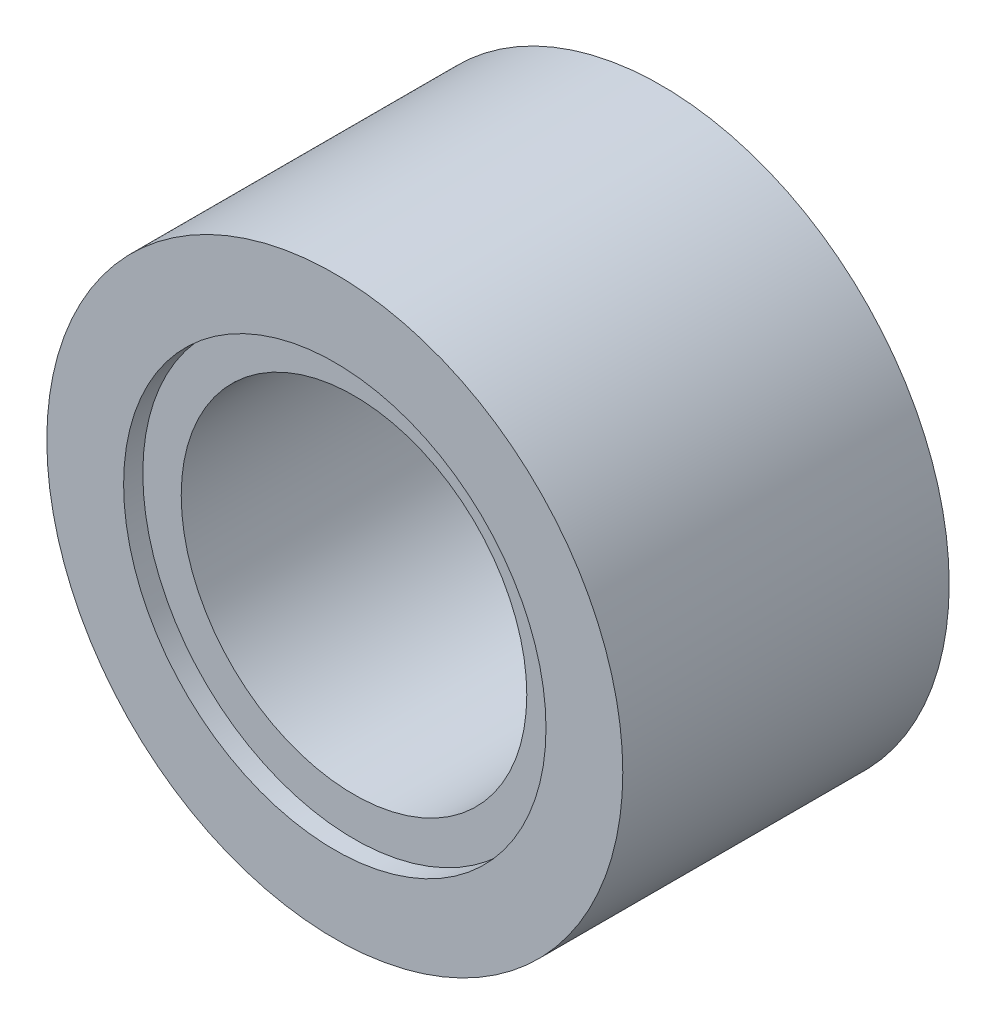
from build123d import *

# Parameters (mm, degrees)
SKETCH1_R           = 30
BOSS_EXTRUDE1_DEPTH = 34
SKETCH2_R           = 18
CUT_EXTRUDE1_DEPTH  = 30
SKETCH4_R           = 22
CUT_EXTRUDE2_DEPTH  = 2


with BuildPart() as part:
    # Sketch1 → Boss-Extrude1 (new body)
    with BuildSketch(Plane.XY):
        Circle(SKETCH1_R)
    extrude(amount=BOSS_EXTRUDE1_DEPTH)

    # Sketch2 → Cut-Extrude1 (cut)
    with BuildSketch(Plane.XY.offset(34)):
        Circle(SKETCH2_R)
    extrude(amount=-CUT_EXTRUDE1_DEPTH, mode=Mode.SUBTRACT)

    # Sketch4 → Cut-Extrude2 (cut)
    with BuildSketch(Plane.XY.offset(34)):
        Circle(SKETCH4_R)
    extrude(amount=-CUT_EXTRUDE2_DEPTH, mode=Mode.SUBTRACT)


solid = part.part
